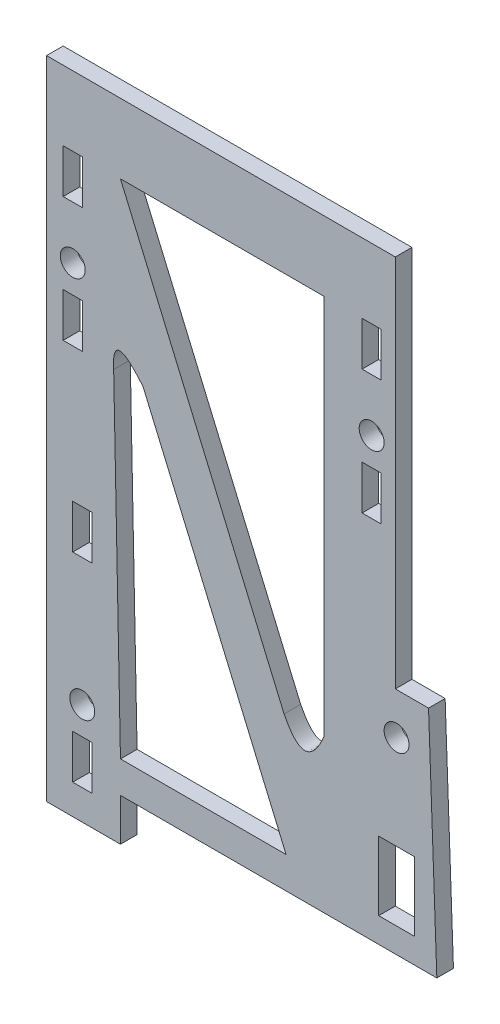
from build123d import *

# Parameters (mm, degrees)
SKETCH_1_R      = 1.5
SKETCH_1_W      = 2.3
SKETCH_1_H      = 5.3
SKETCH_1_W_2    = 4.3
SKETCH_1_H_2    = 8.3
EXTRUDE_1_DEPTH = 2


with BuildPart() as part:
    # 草图1 → 凸台-拉伸1 (new body)
    with BuildSketch(Plane.XY):
        Polygon((24.667061038, 17.348475873), (24.667061038, -27.701524127), (26.667061038, -27.701524127), (28.667061038, -27.701524127), (29.667061038, -55.351524127), (22.667061038, -55.351524127), (20.667061038, -55.351524127), (-8.432938962, -55.351524127), (-8.432938962, -60.451524127), (-17.332938962, -60.451524127), (-17.332938962, -14.651524127), (-17.332938962, -11.651524127), (-17.332938962, 17.348475873), align=None)
        with Locations((-14.182938962, -2.700971973)):
            Circle(SKETCH_1_R, mode=Mode.SUBTRACT)
        with Locations((21.817061038, -2.700971973)):
            Circle(SKETCH_1_R, mode=Mode.SUBTRACT)
        with Locations((24.817061038, -32.701524127)):
            Circle(SKETCH_1_R, mode=Mode.SUBTRACT)
        with Locations((-13.032938962, -48.201524127)):
            Circle(SKETCH_1_R, mode=Mode.SUBTRACT)
        with Locations((-14.182938962, -8.700971973)):
            Rectangle(SKETCH_1_W, SKETCH_1_H, mode=Mode.SUBTRACT)
        with Locations((-14.182938962, 6.299028027)):
            Rectangle(SKETCH_1_W, SKETCH_1_H, mode=Mode.SUBTRACT)
        with Locations((21.817061038, 6.299028027)):
            Rectangle(SKETCH_1_W, SKETCH_1_H, mode=Mode.SUBTRACT)
        with Locations((21.817061038, -8.700971973)):
            Rectangle(SKETCH_1_W, SKETCH_1_H, mode=Mode.SUBTRACT)
        with Locations((24.817061038, -48.201524127)):
            Rectangle(SKETCH_1_W_2, SKETCH_1_H_2, mode=Mode.SUBTRACT)
        with BuildLine():
            Line((-8.432938962, 8.949028027), (16.067061038, 8.949028027))
            Line((16.067061038, 8.949028027), (16.067061038, -37.010661405))
            add(Edge.make_bspline(
                [(11.269624681, -37.010661405), (13.852400302, -42.144100828), (16.067061038, -37.010661405)],
                knots=[0, 0, 0, 1, 1, 1], degree=2))
            Line((11.269624681, -37.010661405), (-8.432938962, 8.949028027))
        make_face(mode=Mode.SUBTRACT)
        with BuildLine():
            Line((-8.432938962, -51.551524127), (-9.251133438, -11.350971973))
            add(Edge.make_bspline(
                [(-5.718997159, -11.350971973), (-9.541336837, -6.716135438), (-9.251133438, -11.350971973)],
                knots=[0, 0, 0, 1, 1, 1], degree=2))
            Line((-5.718997159, -11.350971973), (11.269624681, -50.979915585))
            Line((11.269624681, -50.979915585), (11.514668845, -51.551524127))
            Line((11.514668845, -51.551524127), (-8.432938962, -51.551524127))
        make_face(mode=Mode.SUBTRACT)
        with Locations((-13.032938962, -54.201524127)):
            Rectangle(SKETCH_1_W, SKETCH_1_H, mode=Mode.SUBTRACT)
        with Locations((-13.032938962, -30.201524127)):
            Rectangle(SKETCH_1_W, SKETCH_1_H, mode=Mode.SUBTRACT)
    extrude(amount=EXTRUDE_1_DEPTH)


solid = part.part
